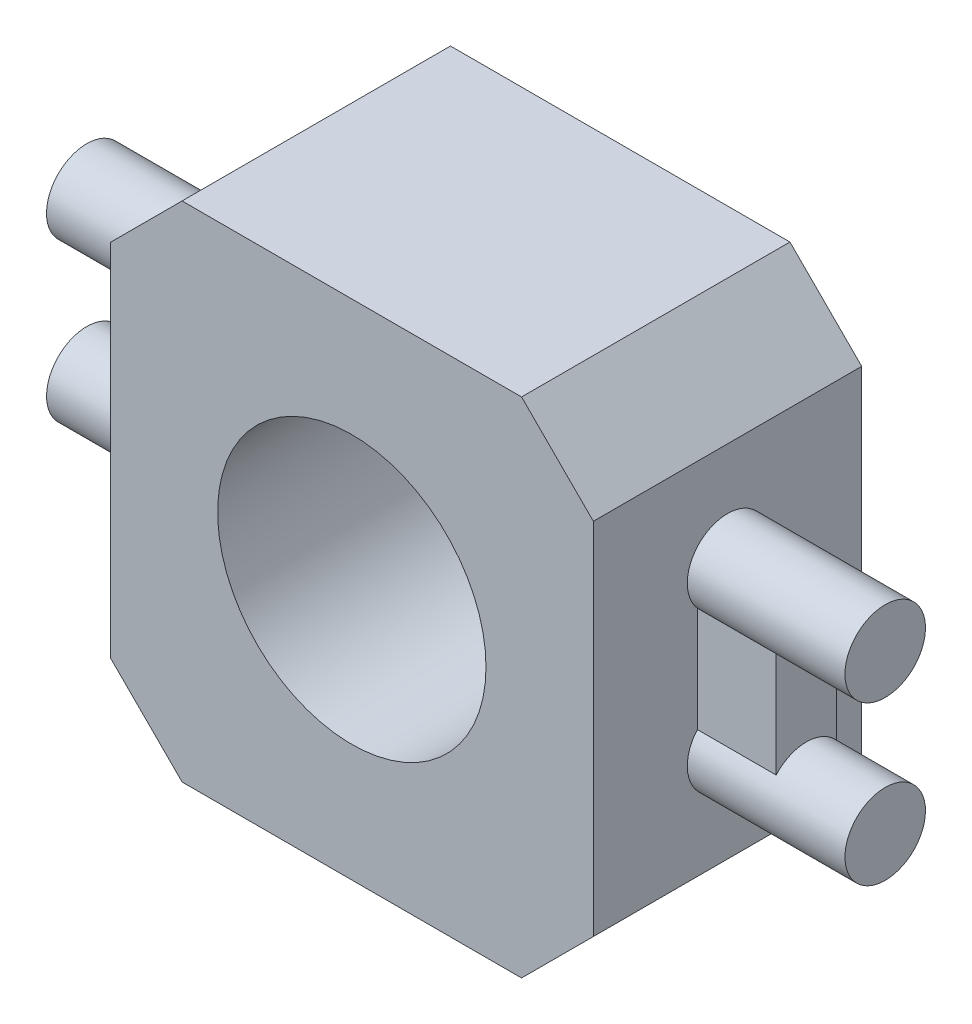
from build123d import *

# Parameters (mm, degrees)
BOSS_EXTRUDE1_DEPTH = 4
SKETCH2_R           = 2
CUT_EXTRUDE1_DEPTH  = 7.559153909
SKETCH3_R           = 0.6
BOSS_EXTRUDE4_DEPTH = 2.35
SKETCH5_W           = 0.9
SKETCH5_H           = 2.53219409
BOSS_EXTRUDE5_DEPTH = 1.175
BOSS_EXTRUDE6_START = 2.35
SKETCH6_R           = 0.6
BOSS_EXTRUDE6_DEPTH = 2.35
SKETCH8_W           = 0.9
SKETCH8_H           = 2.405916694
BOSS_EXTRUDE7_DEPTH = 1.175


with BuildPart() as part:
    # Sketch1 → Boss-Extrude1 (new body)
    with BuildSketch(Plane.XY):
        Polygon((-2.53, 3.75), (-3.6, 2.68), (-3.6, -2.68), (-2.53, -3.75), (2.53, -3.75), (3.6, -2.68), (3.6, 2.68), (2.53, 3.75), align=None)
    extrude(amount=BOSS_EXTRUDE1_DEPTH)

    # Sketch2 → Cut-Extrude1 (cut, through all)
    with BuildSketch(Plane.XY.offset(4)):
        Circle(SKETCH2_R)
    extrude(amount=-CUT_EXTRUDE1_DEPTH, mode=Mode.SUBTRACT)

    # Sketch3 → Boss-Extrude4 (add)
    with BuildSketch(Plane.ZY.offset(3.6)):
        with Locations(Location((2.00036098, 1.18, 0), (0, 0, 270))):
            Circle(SKETCH3_R)
        with Locations(Location((2, -1.18, 0), (0, 0, 270))):
            Circle(SKETCH3_R)
    extrude(amount=BOSS_EXTRUDE4_DEPTH)

    # Sketch6 → Boss-Extrude6 (add)
    with BuildSketch(Plane(origin=(3.6, 0, 0), x_dir=(0, 0, -1), z_dir=(1, 0, 0)).offset(BOSS_EXTRUDE6_START)):
        with Locations(Location((-2, 1.18, 0), (0, 0, 90))):
            Circle(SKETCH6_R)
        with Locations(Location((-2, -1.18, 0), (0, 0, 270))):
            Circle(SKETCH6_R)
    extrude(amount=-BOSS_EXTRUDE6_DEPTH)

    # Sketch8 → Boss-Extrude7 (add)
    with BuildSketch(Plane(origin=(3.6, 0, 0), x_dir=(0, 0, -1), z_dir=(1, 0, 0))):
        with Locations((-2, 0.039877072)):
            Rectangle(SKETCH8_W, SKETCH8_H)
    extrude(amount=BOSS_EXTRUDE7_DEPTH)


with BuildPart() as body_2:
    # Sketch5 → Boss-Extrude5 (new body)
    with BuildSketch(Plane.ZY.offset(3.6)):
        with Locations((2.00036098, -0.129600485)):
            Rectangle(SKETCH5_W, SKETCH5_H)
    extrude(amount=BOSS_EXTRUDE5_DEPTH)


solid = Compound([part.part, body_2.part])
